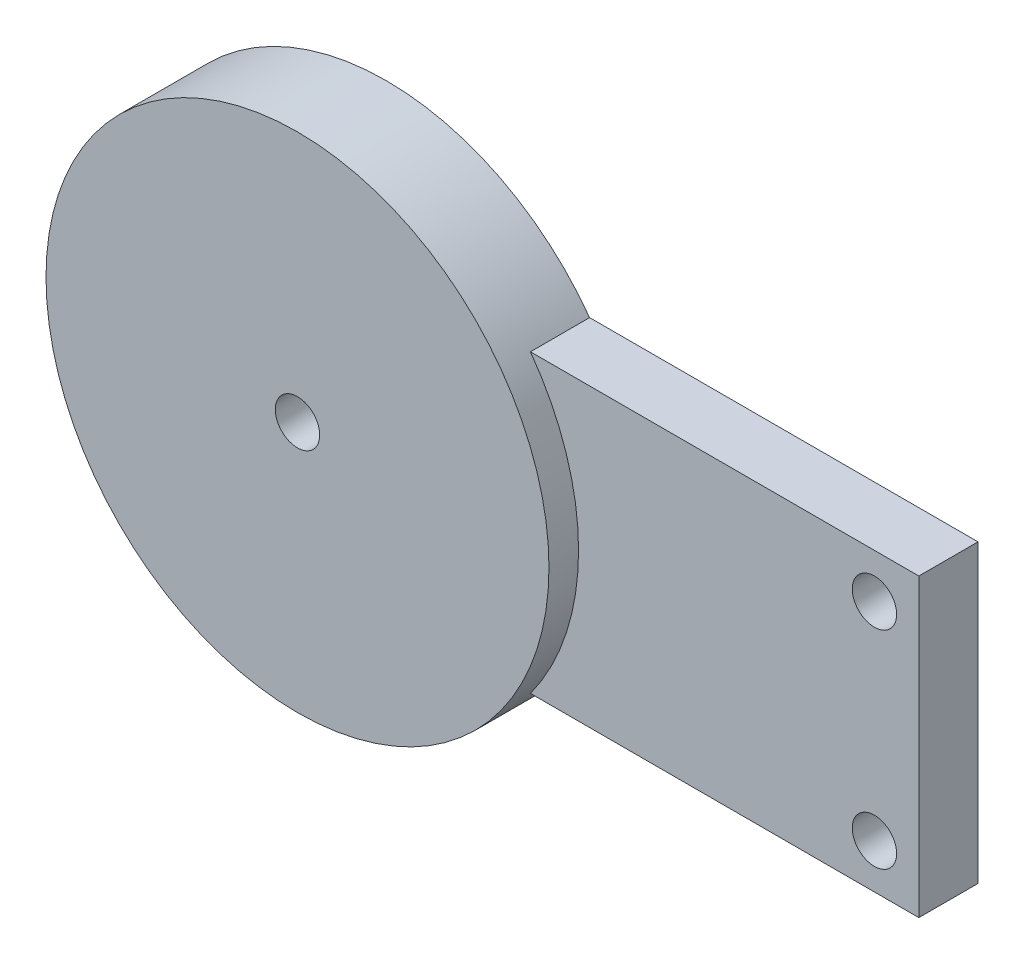
from build123d import *

# Parameters (mm, degrees)
SKETCH1_W                       = 40
SKETCH1_H                       = 20
BOSS_EXTRUDE1_DEPTH             = 2
BOSS_EXTRUDE2_REACH             = 24.716
SKETCH6_R                       = 17
BOSS_EXTRUDE2_DIRECTION_2_DEPTH = 2
SKETCH7_R                       = 2.5
CUT_EXTRUDE3_DEPTH              = 3
CIRPATTERN1_COUNT               = 6
FILLET3_R                       = 1
CUT_EXTRUDE4_REACH              = 43.158
SKETCH8_R                       = 1.5
CUT_EXTRUDE5_REACH              = 42.915
SKETCH9_R                       = 1.5


with BuildPart() as part:
    # Sketch1 → Boss-Extrude1 (new, symmetric)
    with BuildSketch(Plane.XY):
        Rectangle(SKETCH1_W, SKETCH1_H)
    extrude(amount=BOSS_EXTRUDE1_DEPTH, both=True)

    # Boss-Extrude2: up to this face of the body (flat: up to its plane)
    boss_extrude2_end = Plane(part.part.faces().sort_by_distance((0, 0, -2))[0])
    # Sketch6 → Boss-Extrude2 (add, up to the picked face)
    with BuildSketch(Plane.XY.offset(2), mode=Mode.PRIVATE) as boss_extrude2_sk1:
        with Locations(Location((-20, 0, 0), (0, 0, 36.031879072))):
            Circle(SKETCH6_R)
    boss_extrude2_tool1 = split(extrude(boss_extrude2_sk1.sketch, amount=-BOSS_EXTRUDE2_REACH, mode=Mode.PRIVATE), bisect_by=boss_extrude2_end, keep=Keep.BOTH, mode=Mode.PRIVATE)
    add(boss_extrude2_tool1.solids().sort_by(Axis((-20, 0, 2), (0, 0, -1)))[0])

    # Sketch6 → Boss-Extrude2 direction 2 (add)
    with BuildSketch(Plane.XY.offset(2)):
        with Locations(Location((-20, 0, 0), (0, 0, 36.031879072))):
            Circle(SKETCH6_R)
    extrude(amount=BOSS_EXTRUDE2_DIRECTION_2_DEPTH)

    # Sketch7 → Cut-Extrude3 (cut)
    with BuildSketch(Plane(origin=(0, 0, -2), x_dir=(-1, 0, 0), z_dir=(0, 0, -1))):
        with BuildLine():
            Line((21.148365434, 4.169758006), (20, 4.325))
            ThreePointArc((20, 4.325), (15.675, 0), (20, -4.325))
            Line((20, -4.325), (21.148365434, -4.169758006))
            ThreePointArc((21.148365434, -4.169758006), (23.440371019, -2.620967808), (24.325, 0))
            ThreePointArc((24.325, 0), (23.440371019, 2.620967808), (21.148365434, 4.169758006))
        make_face()
        with BuildLine():
            Line((33.5, 2.5), (21.148365434, 4.169758006))
            ThreePointArc((21.148365434, 4.169758006), (23.440371019, 2.620967808), (24.325, 0))
            ThreePointArc((24.325, 0), (23.440371019, -2.620967808), (21.148365434, -4.169758006))
            Line((21.148365434, -4.169758006), (33.5, -2.5))
            ThreePointArc((33.5, -2.5), (31, 0), (33.5, 2.5))
        make_face()
        with Locations((33.5, 0)):
            Circle(SKETCH7_R)
    cut_extrude3 = extrude(amount=-CUT_EXTRUDE3_DEPTH, mode=Mode.SUBTRACT)

    # CirPattern1: Cut-Extrude3 ×6 about axis
    cirpattern1_axis = Axis((-20, 0, 0), (0, 0, 1))
    for i in range(1, CIRPATTERN1_COUNT):
        add(cut_extrude3.rotate(cirpattern1_axis, i * 360 / CIRPATTERN1_COUNT), mode=Mode.SUBTRACT)

    # Fillet3
    fillet3_edges = [part.edges().sort_by_distance(p)[0] for p in [
        (-26.069873399, 3.504443041, -0.5),
        (-20, 7.008886081, -0.5),
        (-13.930126601, 3.504443041, -0.5),
        (-13.930126601, -3.504443041, -0.5),
        (-20, -7.008886081, -0.5),
        (-26.069873399, -3.504443041, -0.5),
    ]]
    fillet(fillet3_edges, radius=FILLET3_R)

    # Sketch8 → Cut-Extrude4 (cut, up to next)
    with BuildSketch(Plane.XY.offset(4), mode=Mode.PRIVATE) as cut_extrude4_sk1:
        with Locations((-20, 0)):
            Circle(SKETCH8_R)
    cut_extrude4_tool1 = extrude(cut_extrude4_sk1.sketch, amount=-CUT_EXTRUDE4_REACH, mode=Mode.PRIVATE) & part.part
    add(cut_extrude4_tool1.solids().sort_by_distance((-20, 0, 4))[0], mode=Mode.SUBTRACT)

    # Sketch9 → Cut-Extrude5 (cut, up to next)
    with BuildSketch(Plane.XY.offset(2), mode=Mode.PRIVATE) as cut_extrude5_sk1:
        with Locations((17, 7)):
            Circle(SKETCH9_R)
    cut_extrude5_tool1 = extrude(cut_extrude5_sk1.sketch, amount=-CUT_EXTRUDE5_REACH, mode=Mode.PRIVATE) & part.part
    # Sketch9 → Cut-Extrude5 (cut, up to next)
    with BuildSketch(Plane.XY.offset(2), mode=Mode.PRIVATE) as cut_extrude5_sk2:
        with Locations((17, -7)):
            Circle(SKETCH9_R)
    cut_extrude5_tool2 = extrude(cut_extrude5_sk2.sketch, amount=-CUT_EXTRUDE5_REACH, mode=Mode.PRIVATE) & part.part
    add(cut_extrude5_tool1.solids().sort_by_distance((17, 7, 2))[0], mode=Mode.SUBTRACT)
    add(cut_extrude5_tool2.solids().sort_by_distance((17, -7, 2))[0], mode=Mode.SUBTRACT)


solid = part.part
